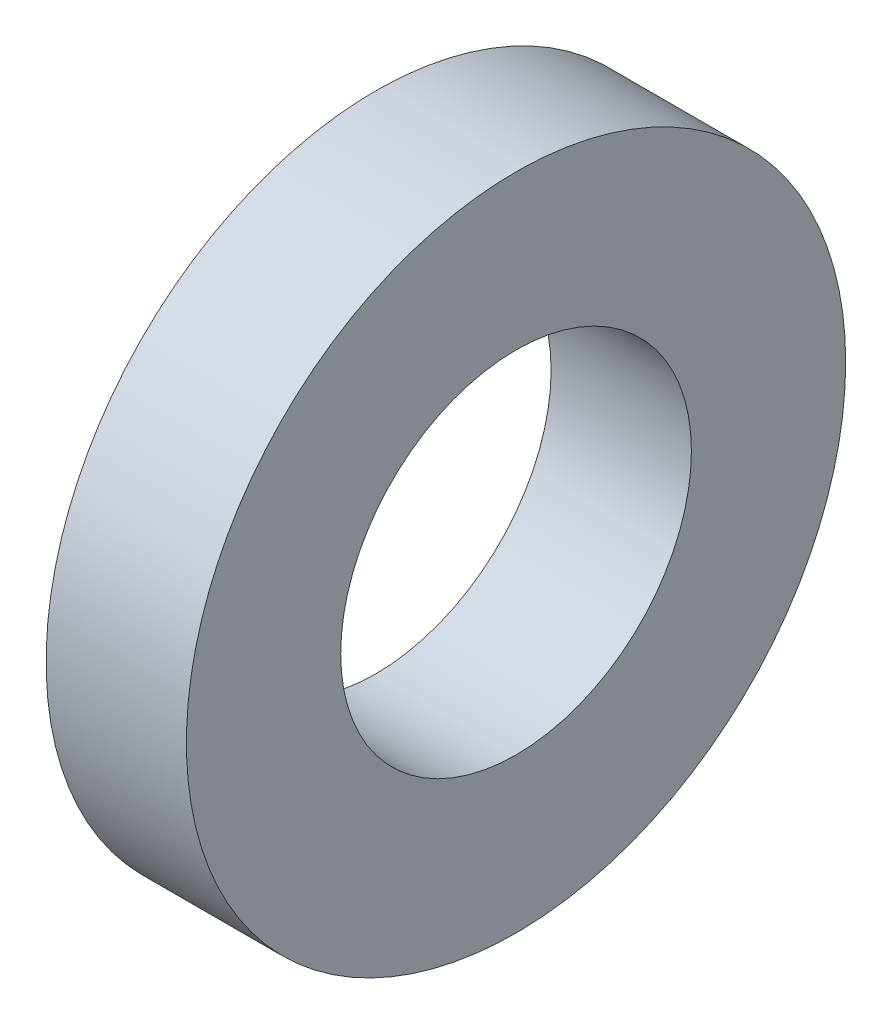
from build123d import *

# Parameters (mm, degrees)
SKETCH1_R           = 23.5
SKETCH1_R_2         = 12.5
BOSS_EXTRUDE1_DEPTH = 10


with BuildPart() as part:
    # Sketch1 → Boss-Extrude1 (new body)
    with BuildSketch(Plane.YZ):
        with Locations(Location((0, 0, 0), (0, 0, 270))):
            Circle(SKETCH1_R)
        with Locations(Location((0, 0, 0), (0, 0, 270))):
            Circle(SKETCH1_R_2, mode=Mode.SUBTRACT)
    extrude(amount=BOSS_EXTRUDE1_DEPTH)


solid = part.part
